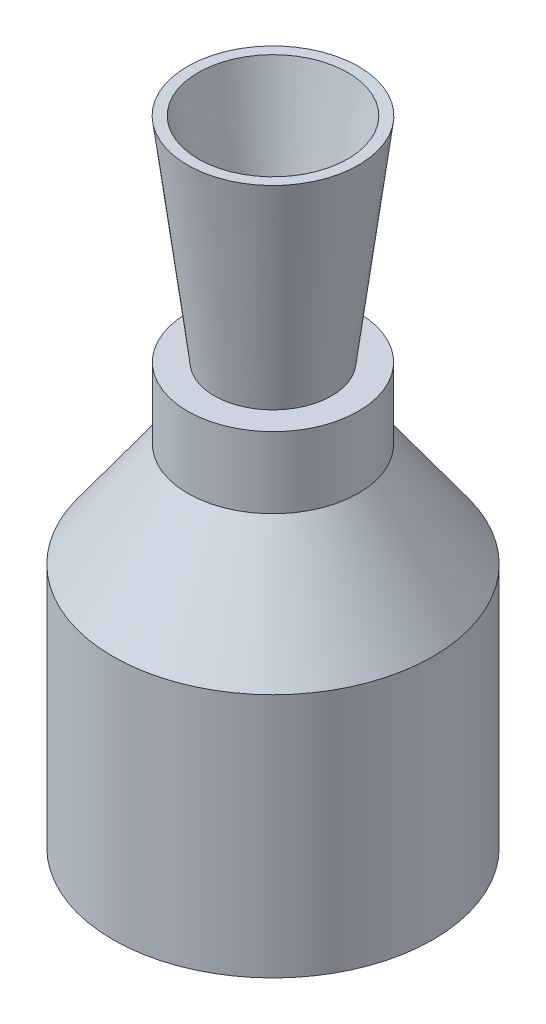
from build123d import *

# Parameters (mm, degrees)
SKETCH1_R           = 22.5
SKETCH1_R_2         = 21
BOSS_EXTRUDE1_DEPTH = 34.5


with BuildPart() as part:
    # Sketch1 → Boss-Extrude1 (new body)
    with BuildSketch(Plane(origin=(0, 0, 0), x_dir=(1, 0, 0), z_dir=(0, 1, 0))):
        with Locations(Location((0, 0, 0), (0, 0, 270))):
            Circle(SKETCH1_R)
        with Locations(Location((0, 0, 0), (0, 0, 270))):
            Circle(SKETCH1_R_2, mode=Mode.SUBTRACT)
    extrude(amount=BOSS_EXTRUDE1_DEPTH)

    # Sketch5 → Revolve1 (revolve)
    with BuildSketch(Plane.XY, mode=Mode.PRIVATE) as revolve1_sk:
        Polygon((22.5, 34.5), (12, 49.120191517), (12, 59.120191517), (3.5, 59.120191517), (3.5, 49.120191517), (21, 34.5), align=None)
    revolve(revolve1_sk.sketch.rotate(Axis((0, 0, 0), (0, 1, 0)), 90), axis=Axis((0, 0, 0), (0, 1, 0)))

    # Sketch10 → Revolve3 (revolve)
    with BuildSketch(Plane(origin=(0, 0, 0), x_dir=(-1, 0, 0), z_dir=(0, 0, -1)), mode=Mode.PRIVATE) as revolve3_sk:
        Polygon((-3.5, 59.120191517), (-10.526661033, 89.120191517), (-12.026661033, 89.120191517), (-8.25, 59.120191517), align=None)
    revolve(revolve3_sk.sketch.rotate(Axis((0, 59.120191517, 0), (0, 1, 0)), 90), axis=Axis((0, 59.120191517, 0), (0, 1, 0)))


solid = part.part
